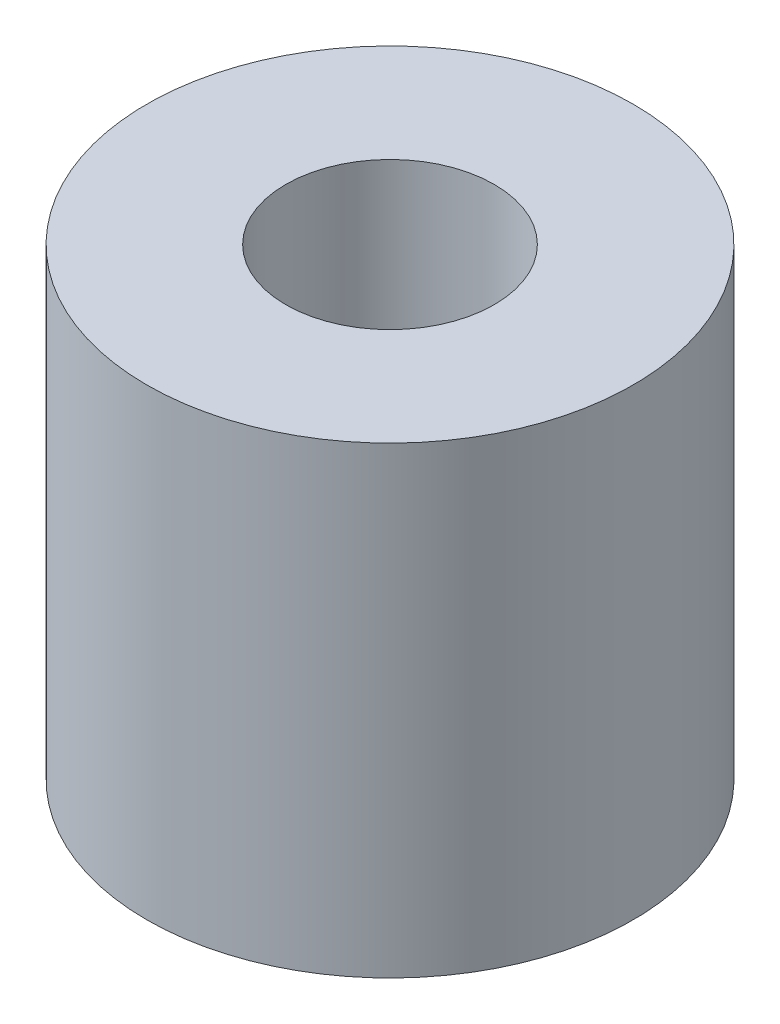
from build123d import *

# Parameters (mm, degrees)
SKETCH1_R           = 21
SKETCH1_R_2         = 9
BOSS_EXTRUDE1_DEPTH = 40


with BuildPart() as part:
    # Sketch1 → Boss-Extrude1 (new body)
    with BuildSketch(Plane(origin=(0, 0, 0), x_dir=(1, 0, 0), z_dir=(0, 1, 0))):
        with Locations(Location((0, 0, 0), (0, 0, 270))):
            Circle(SKETCH1_R)
        with Locations(Location((0, 0, 0), (0, 0, 270))):
            Circle(SKETCH1_R_2, mode=Mode.SUBTRACT)
    extrude(amount=BOSS_EXTRUDE1_DEPTH)


solid = part.part
